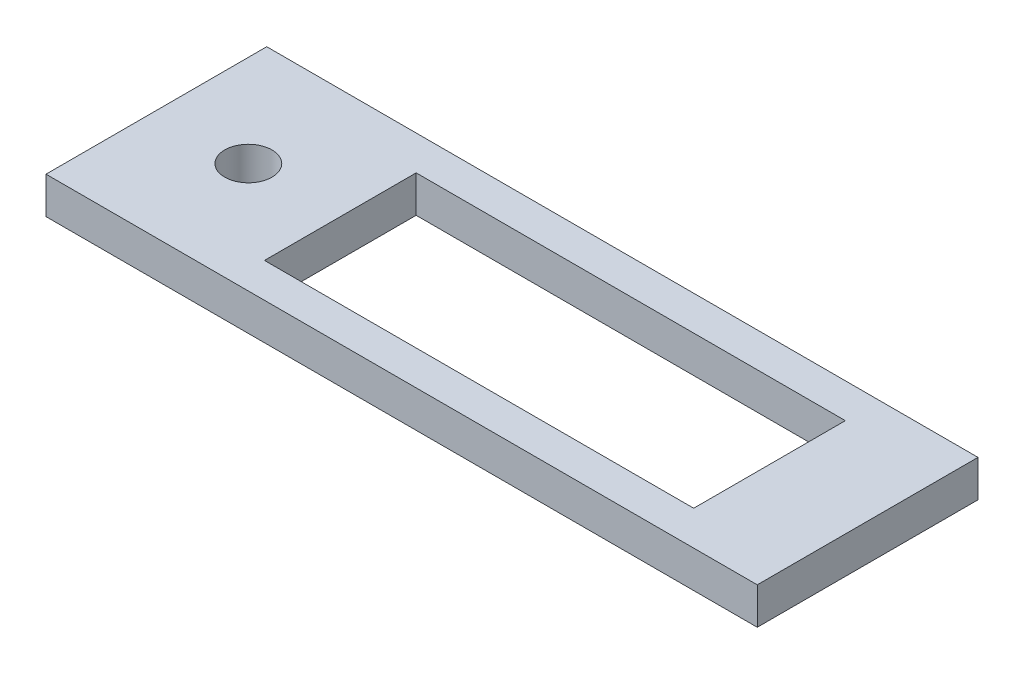
from build123d import *

# Parameters (mm, degrees)
SKETCH1_W           = 58
SKETCH1_H           = 18
SKETCH1_R           = 1.927548047
SKETCH1_W_2         = 35
SKETCH1_H_2         = 12.368270078
BOSS_EXTRUDE1_DEPTH = 3


with BuildPart() as part:
    # Sketch1 → Boss-Extrude1 (new body)
    with BuildSketch(Plane(origin=(0, 0, 0), x_dir=(1, 0, 0), z_dir=(0, 1, 0))):
        with Locations((-2.583906322, 0)):
            Rectangle(SKETCH1_W, SKETCH1_H)
        with Locations(Location((-24.083906322, 0, 0), (0, 0, 270))):
            Circle(SKETCH1_R, mode=Mode.SUBTRACT)
        with Locations((0.916093678, 0)):
            Rectangle(SKETCH1_W_2, SKETCH1_H_2, mode=Mode.SUBTRACT)
    extrude(amount=BOSS_EXTRUDE1_DEPTH)


solid = part.part
